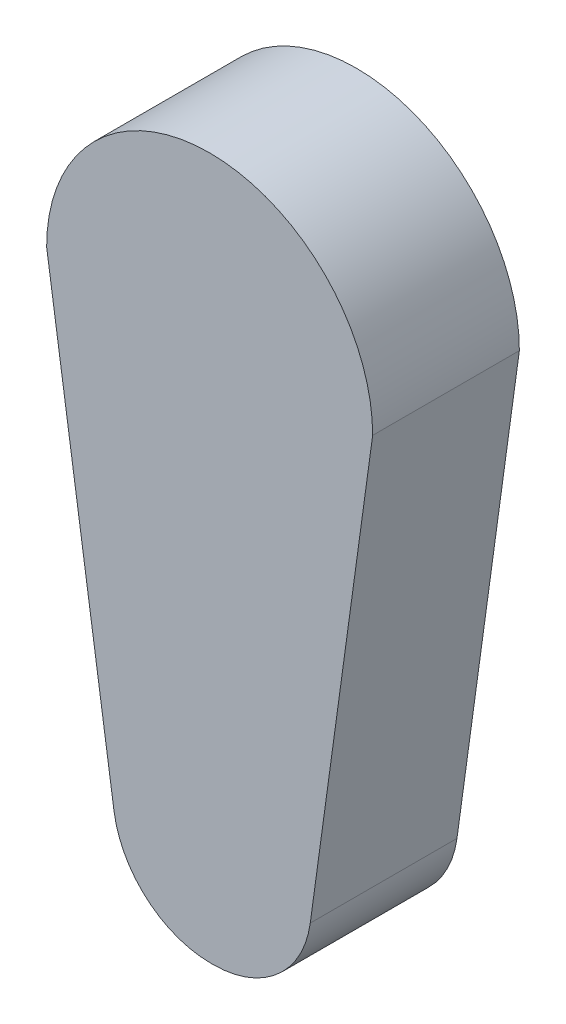
from build123d import *

# Parameters (mm, degrees)
BOSS_EXTRUDE1_DEPTH = 0.45
SCALE2_SCALE        = 10
SKETCH4_R           = 0.5334
SKETCH4_R_2         = 2
CUT_EXTRUDE5_DEPTH  = 2.94
SKETCH4_3_R         = 0.5334
SKETCH4_3_R_2       = 2
CUT_EXTRUDE6_DEPTH  = 2.5
CUT_EXTRUDE7_DEPTH  = 4.5
FILLET5_R           = 3


with BuildPart() as part:
    # Sketch1 → Boss-Extrude1 (new body)
    with BuildSketch(Plane.XY):
        with BuildLine():
            Line((-0.136993219, -2.45), (0.163006781, -2.450375949))
            Line((0.163006781, -2.450375949), (0.499999859, -0.000375949))
            ThreePointArc((0.499999859, -0.000375949), (0.000187974, 0.499999965), (-0.5, 0))
            Line((-0.5, 0), (-0.136993219, -2.45))
        make_face()
    extrude(amount=BOSS_EXTRUDE1_DEPTH)


with BuildPart() as part_1:
    # Scale2: scaled about (0.004303075, -0.764400295, 0.225)
    add(part.part.scale(SCALE2_SCALE).moved(Location((-0.038727675, 6.879602655, -2.025))))

    # Sketch4 → Cut-Extrude5 (cut)
    with BuildSketch(Plane(origin=(0, 0, -2.025), x_dir=(-1, 0, 0), z_dir=(0, 0, -1))):
        with Locations((0.043782342, 0.298259193)):
            Circle(SKETCH4_R)
        with Locations((0.044722007, -1.403540547)):
            Circle(SKETCH4_R)
        with Locations((0.045661673, -3.105340288)):
            Circle(SKETCH4_R)
        with Locations((0.046601338, -4.807140028)):
            Circle(SKETCH4_R)
        with Locations((0.047541004, -6.508939769)):
            Circle(SKETCH4_R)
        with Locations((0.048480669, -8.21073951)):
            Circle(SKETCH4_R)
        with Locations((0.040405857, 6.413308261)):
            Circle(SKETCH4_R_2)
    extrude(amount=-CUT_EXTRUDE5_DEPTH, mode=Mode.SUBTRACT)

    # Sketch4<3> → Cut-Extrude6 (cut)
    with BuildSketch(Plane(origin=(0, 0, -2.025), x_dir=(-1, 0, 0), z_dir=(0, 0, -1))):
        with BuildLine():
            Line((1.794435881, -7.676375382), (2.854667965, 4.218872462))
            ThreePointArc((2.854667965, 4.218872462), (0.038435364, 9.982007717), (-2.771431177, 4.215765956))
            Line((-2.771431177, 4.215765956), (-1.698063587, -7.6783038))
            ThreePointArc((-1.698063587, -7.6783038), (0.049150356, -9.423589325), (1.794435881, -7.676375382))
        make_face()
        with Locations((0.043782342, 0.298259193)):
            Circle(SKETCH4_3_R, mode=Mode.SUBTRACT)
        with Locations((0.044722007, -1.403540547)):
            Circle(SKETCH4_3_R, mode=Mode.SUBTRACT)
        with Locations((0.045661673, -3.105340288)):
            Circle(SKETCH4_3_R, mode=Mode.SUBTRACT)
        with Locations((0.046601338, -4.807140028)):
            Circle(SKETCH4_3_R, mode=Mode.SUBTRACT)
        with Locations((0.047541004, -6.508939769)):
            Circle(SKETCH4_3_R, mode=Mode.SUBTRACT)
        with Locations((0.048480669, -8.21073951)):
            Circle(SKETCH4_3_R, mode=Mode.SUBTRACT)
        with Locations((0.040405857, 6.413308261)):
            Circle(SKETCH4_3_R_2, mode=Mode.SUBTRACT)
    extrude(amount=-CUT_EXTRUDE6_DEPTH, mode=Mode.SUBTRACT)

    # Sketch5 → Cut-Extrude7 (cut)
    with BuildSketch(Plane(origin=(0, 0, -2.025), x_dir=(-1, 0, 0), z_dir=(0, 0, -1))):
        Polygon((-2.691750397, -9.628866056), (2.593406399, -9.628866056), (1.408635162, -17.625106571), (-1.591364838, -17.628866056), align=None)
    extrude(amount=-CUT_EXTRUDE7_DEPTH, mode=Mode.SUBTRACT)

    # Fillet5
    fillet5_edges = [part_1.edges().sort_by_distance(p)[0] for p in [
        (-2.592733353, -9.628866056, 0.225),
        (2.691077951, -9.628866056, 0.225),
    ]]
    fillet(fillet5_edges, radius=FILLET5_R)


solid = part_1.part
